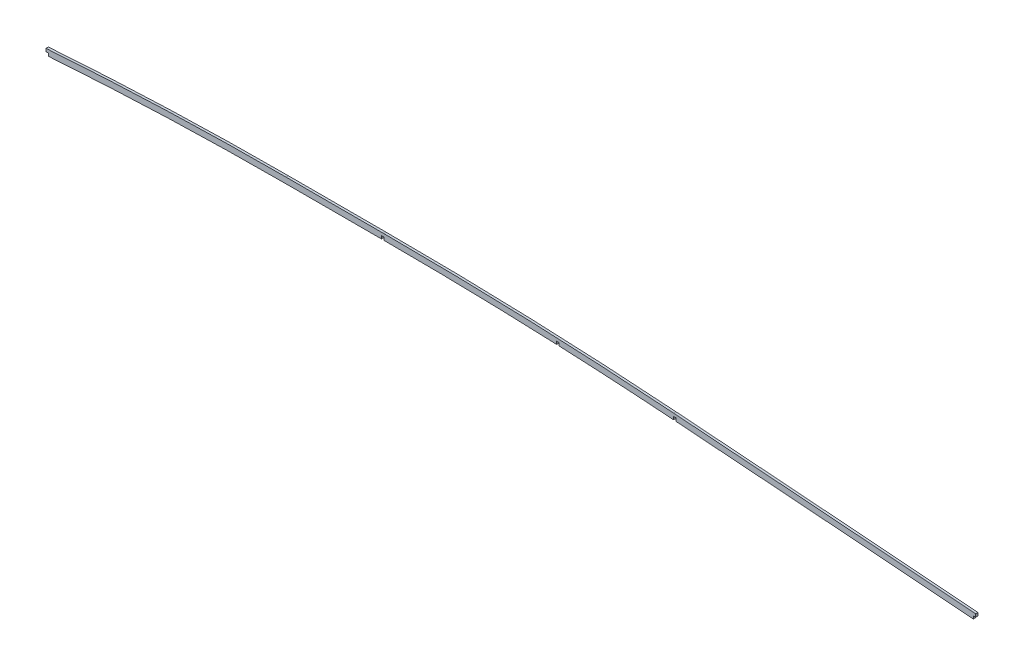
from build123d import *

# Parameters (mm, degrees)
BOSS_EXTRUDE1_DEPTH = 10


with BuildPart() as part:
    # Sketch1 → Boss-Extrude1 (new body)
    with BuildSketch(Plane.XY):
        with BuildLine():
            Line((-608.870505757, 282.023599337), (-608.870505757, 269.49207832))
            Line((-608.870505757, 269.49207832), (-598.870505757, 269.49207832))
            Line((-598.870505757, 269.49207832), (-598.870505757, 257.668308621))
            ThreePointArc((-598.870505757, 257.668308621), (-90.514623069, 284.500507433), (418.470256952, 293.448259545))
            Line((418.470256952, 293.448259545), (825.79936838, 293.448259545))
            Line((825.79936838, 293.448259545), (825.799368379, 305.948259545))
            Line((825.799368379, 305.948259545), (835.799368379, 305.948259545))
            Line((835.799368379, 305.948259545), (835.799368381, 293.448259545))
            ThreePointArc((835.799368381, 293.448259545), (1133.661186166, 290.835244695), (1431.431319542, 282.997004454))
            ThreePointArc((1431.431319542, 282.997004454), (1503.085939586, 280.330146604), (1574.728657642, 277.360693119))
            Line((1574.728657642, 277.360693119), (1574.728657641, 289.434265214))
            Line((1574.728657641, 289.434265214), (1584.728657641, 289.434265214))
            Line((1584.728657641, 289.434265214), (1584.728657641, 276.922104092))
            ThreePointArc((1584.728657641, 276.922104092), (1641.039746916, 274.342060096), (1697.341959691, 271.575069153))
            ThreePointArc((1697.341959691, 271.575069153), (1885.188935099, 260.986829911), (2072.907043911, 248.31763089))
            ThreePointArc((2072.907043911, 248.31763089), (2073.81785089, 248.251086909), (2074.728657642, 248.184539822))
            Line((2074.728657642, 248.184539822), (2074.728657641, 260.684539822))
            Line((2074.728657641, 260.684539822), (2084.728657641, 260.684539822))
            Line((2084.728657641, 260.684539822), (2084.728657642, 247.453695579))
            ThreePointArc((2084.728657642, 247.453695579), (2720.696358676, 200.201158042), (3356.549748161, 151.43450813))
            Line((3356.549748161, 151.43450813), (3356.549748161, 163.1932914))
            Line((3356.549748161, 163.1932914), (3366.549748161, 163.1932914))
            Line((3366.549748161, 163.1932914), (3366.549748161, 175.731187268))
            ThreePointArc((3366.549748161, 175.731187268), (2720.698159353, 225.272162423), (2074.728657642, 273.251177036))
            ThreePointArc((2074.728657642, 273.251177036), (1886.73413806, 285.939031173), (1698.61056213, 296.542861364))
            ThreePointArc((1698.61056213, 296.542861364), (1267.343978626, 312.97102781), (835.79936838, 318.448259545))
            Line((835.79936838, 318.448259545), (418.470256952, 318.448259545))
            ThreePointArc((418.470256952, 318.448259545), (-95.522884684, 309.339234502), (-608.870505757, 282.023599337))
        make_face()
    extrude(amount=BOSS_EXTRUDE1_DEPTH)


solid = part.part
